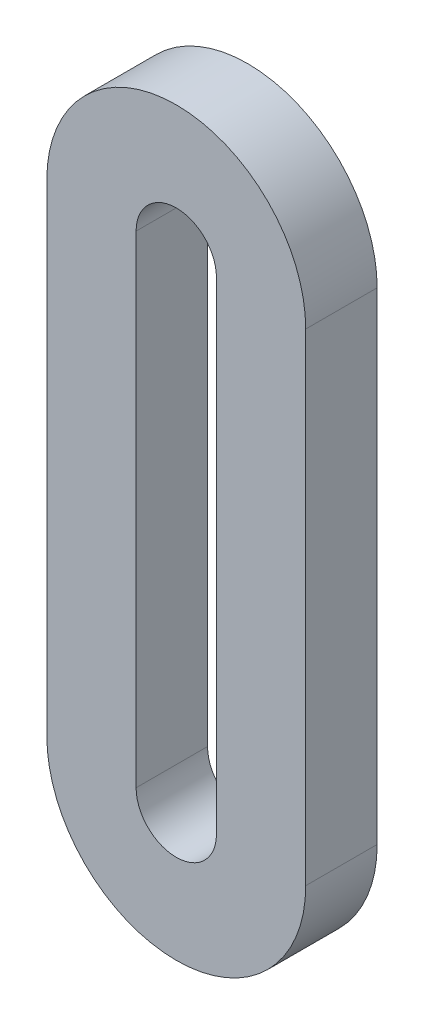
from build123d import *

# Parameters (mm, degrees)
BOSS_EXTRUDE1_DEPTH = 4


with BuildPart() as part:
    # Sketch1 → Boss-Extrude1 (new body)
    with BuildSketch(Plane.XY):
        with BuildLine():
            Line((7.25, 13.5), (7.25, -13.5))
            ThreePointArc((7.25, -13.5), (0, -20.75), (-7.25, -13.5))
            Line((-7.25, -13.5), (-7.25, 13.5))
            ThreePointArc((-7.25, 13.5), (0, 20.75), (7.25, 13.5))
        make_face()
        with BuildLine():
            Line((2.25, 13.5), (2.25, -13.5))
            ThreePointArc((2.25, -13.5), (0, -15.75), (-2.25, -13.5))
            Line((-2.25, -13.5), (-2.25, 13.5))
            ThreePointArc((-2.25, 13.5), (0, 15.75), (2.25, 13.5))
        make_face(mode=Mode.SUBTRACT)
    extrude(amount=BOSS_EXTRUDE1_DEPTH)


solid = part.part
